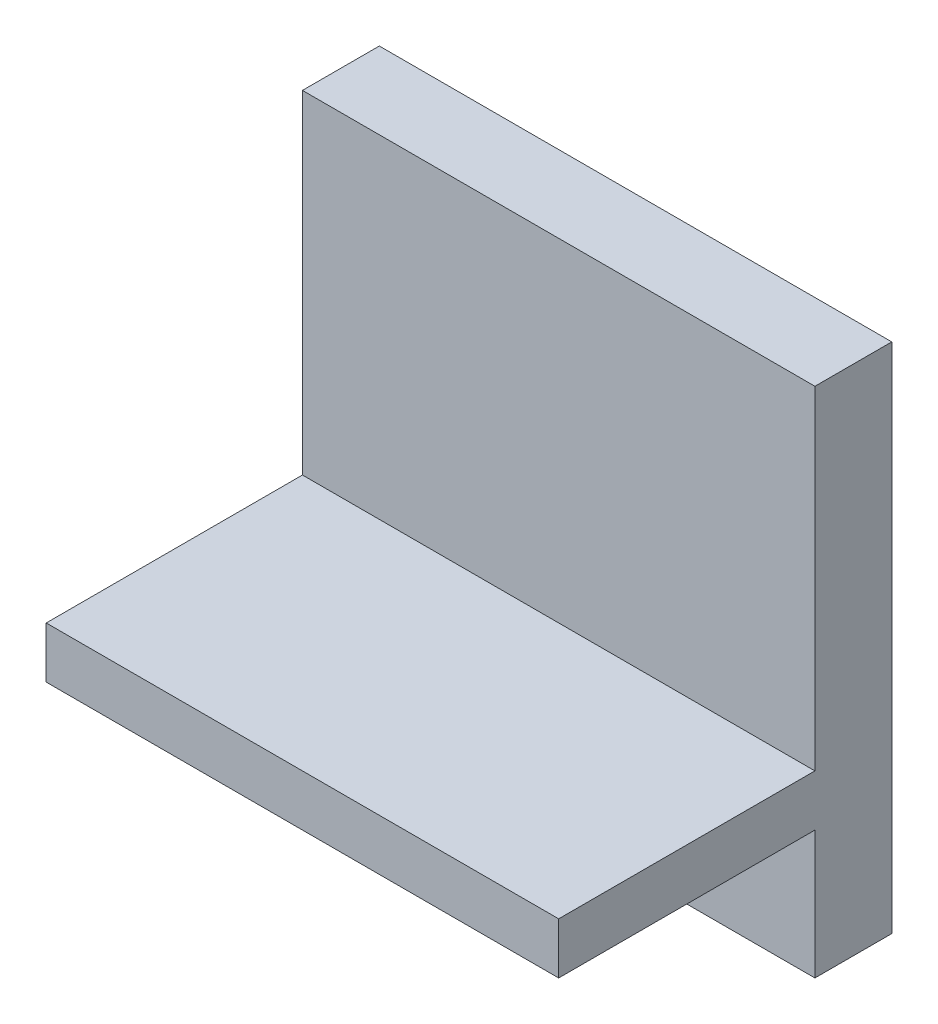
from build123d import *

# Parameters (mm, degrees)
CROQUIS1_W               = 20
CROQUIS1_H               = 3
SALIENTE_EXTRUIR7_DEPTH  = 20
CROQUIS7_W               = 10
CROQUIS7_H               = 5
SALIENTE_EXTRUIR8_DEPTH  = 3
SALIENTE_EXTRUIR10_DEPTH = 10


with BuildPart() as part:
    # Croquis1 → Saliente-Extruir7 (new body)
    with BuildSketch(Plane(origin=(0, 0, 0), x_dir=(1, 0, 0), z_dir=(0, 1, 0))):
        with Locations((10, 1.5)):
            Rectangle(CROQUIS1_W, CROQUIS1_H)
    extrude(amount=SALIENTE_EXTRUIR7_DEPTH)

    # Croquis7 → Saliente-Extruir8 (add)
    with BuildSketch(Plane.XY):
        with Locations((10, 2.5)):
            Rectangle(CROQUIS7_W, CROQUIS7_H)
    extrude(amount=SALIENTE_EXTRUIR8_DEPTH)

    # Croquis8 → Saliente-Extruir10 (add)
    with BuildSketch(Plane.XY):
        Polygon((15, 5), (20, 5), (20, 7), (0, 7), (0, 5), align=None)
    extrude(amount=SALIENTE_EXTRUIR10_DEPTH)


solid = part.part
